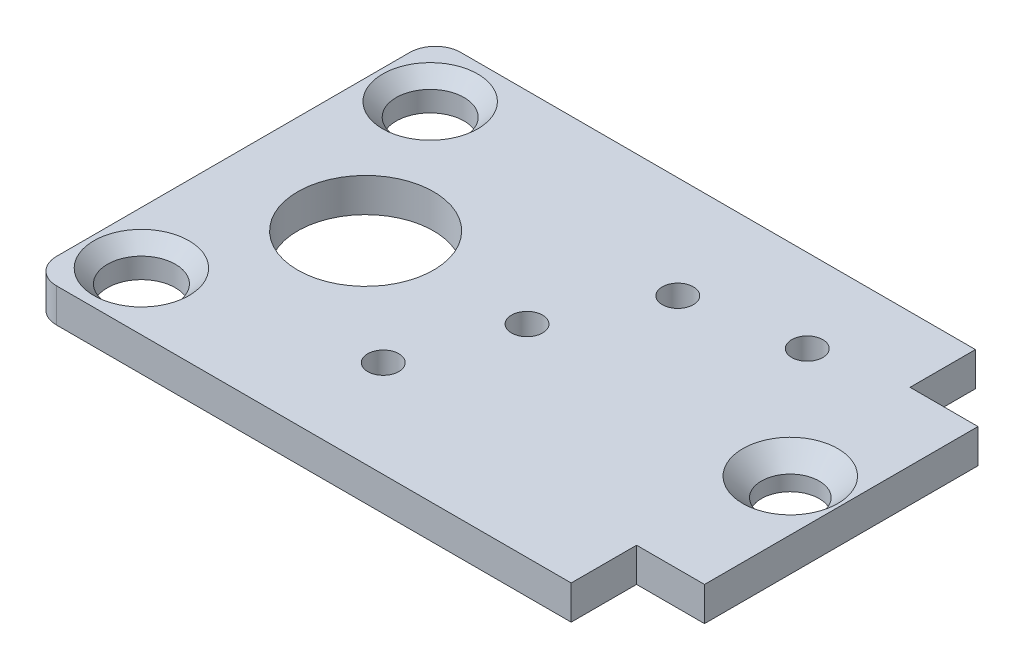
from build123d import *

# Parameters (mm, degrees)
SKETCH1_R           = 2
BOSS_EXTRUDE1_DEPTH = 1
SKETCH2_R           = 1
CUT_EXTRUDE1_DEPTH  = 16.244753196
FILLET1_R           = 0.75
CHAMFER1_SIZE       = 0.4
SKETCH3_R           = 0.4572
CUT_EXTRUDE2_DEPTH  = 16.244753196


with BuildPart() as part:
    # Sketch1 → Boss-Extrude1 (new body)
    with BuildSketch(Plane(origin=(0, 0, 0), x_dir=(1, 0, 0), z_dir=(0, 1, 0))):
        Polygon((12, 5.95), (-3.9, 5.95), (-3.9, -5.95), (12, -5.95), (12, -4.025), (14, -4.025), (14, 4.025), (12, 4.025), align=None)
        with Locations(Location((0, 0, 0), (0, 0, 270))):
            Circle(SKETCH1_R, mode=Mode.SUBTRACT)
    extrude(amount=BOSS_EXTRUDE1_DEPTH)

    # Sketch2 → Cut-Extrude1 (cut, through all)
    with BuildSketch(Plane(origin=(0, 1, 0), x_dir=(1, 0, 0), z_dir=(0, 1, 0))):
        with Locations(Location((-2.35, 4.25, 0), (0, 0, 270))):
            Circle(SKETCH2_R)
        with Locations(Location((-2.35, -4.25, 0), (0, 0, 270))):
            Circle(SKETCH2_R)
    extrude(amount=-CUT_EXTRUDE1_DEPTH, mode=Mode.SUBTRACT)

    # Fillet1
    fillet1_edges = [part.edges().sort_by_distance(p)[0] for p in [
        (-3.9, 0.5, -5.95),
        (-3.9, 0.5, 5.95),
    ]]
    fillet(fillet1_edges, radius=FILLET1_R)

    # Chamfer1
    chamfer1_edges = [part.edges().sort_by_distance(p)[0] for p in [
        (-2.35, 1, -5.25),
        (-2.35, 1, 3.25),
    ]]
    chamfer(chamfer1_edges, length=CHAMFER1_SIZE)

    # Sketch3 → Cut-Extrude2 (cut, through all)
    with BuildSketch(Plane(origin=(0, 1, 0), x_dir=(1, 0, 0), z_dir=(0, 1, 0))):
        with Locations(Location((3.61862915, -3.1, 0), (0, 0, 270))):
            Circle(SKETCH3_R)
        with Locations(Location((4.75, 0, 0), (0, 0, 270))):
            Circle(SKETCH3_R)
        with Locations(Location((6.247772136, 2.94052353, 0), (0, 0, 270))):
            Circle(SKETCH3_R)
        with Locations(Location((9.5, 3.5, 0), (0, 0, 270))):
            Circle(SKETCH3_R)
    extrude(amount=-CUT_EXTRUDE2_DEPTH, mode=Mode.SUBTRACT)

    # Sketch5 → CSK for M1.6 Countersunk Raised Head Screw2 (revolve, cut)
    with BuildSketch(Plane(origin=(12.5, 1, 0), x_dir=(0, 0, 1), z_dir=(1, 0, 0))):
        Polygon((0, 0), (0, 1), (0.85, 1), (0.85, 0.55), (1.4, 0), align=None)
    revolve(axis=Axis((12.5, 7.35, 0), (0, -1, 0)), mode=Mode.SUBTRACT)


solid = part.part
